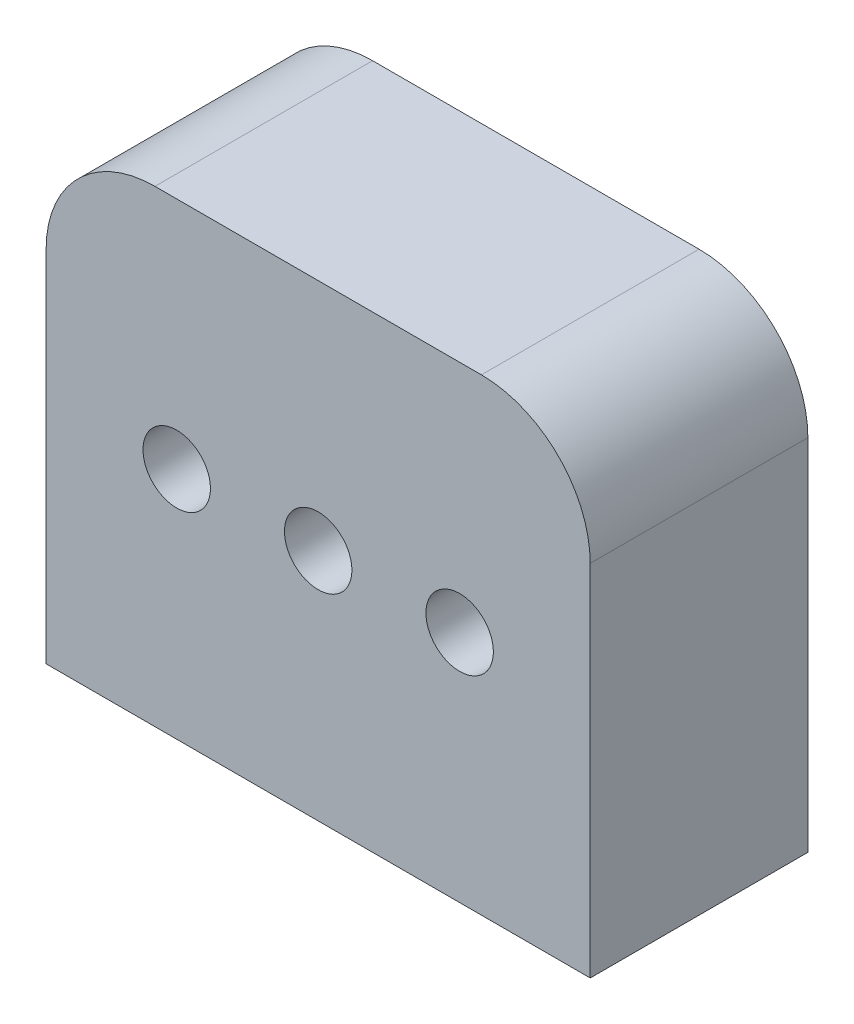
from build123d import *

# Parameters (mm, degrees)
SKETCH1_W           = 12.7
SKETCH1_H           = 10.922
BOSS_EXTRUDE1_DEPTH = 5.08
SKETCH2_R           = 0.7874
CUT_EXTRUDE1_DEPTH  = 5.08
FILLET1_R           = 2.54


with BuildPart() as part:
    # Sketch1 → Boss-Extrude1 (new body)
    with BuildSketch(Plane.XY):
        Rectangle(SKETCH1_W, SKETCH1_H)
    extrude(amount=BOSS_EXTRUDE1_DEPTH)

    # Sketch2 → Cut-Extrude1 (cut)
    with BuildSketch(Plane.XY):
        Circle(SKETCH2_R)
        with Locations((3.302, 0)):
            Circle(SKETCH2_R)
        with Locations((-3.302, 0)):
            Circle(SKETCH2_R)
    extrude(amount=CUT_EXTRUDE1_DEPTH, mode=Mode.SUBTRACT)

    # Fillet1
    fillet1_edges = [part.edges().sort_by_distance(p)[0] for p in [
        (-6.35, 5.461, 2.54),
        (6.35, 5.461, 2.54),
    ]]
    fillet(fillet1_edges, radius=FILLET1_R)


solid = part.part
